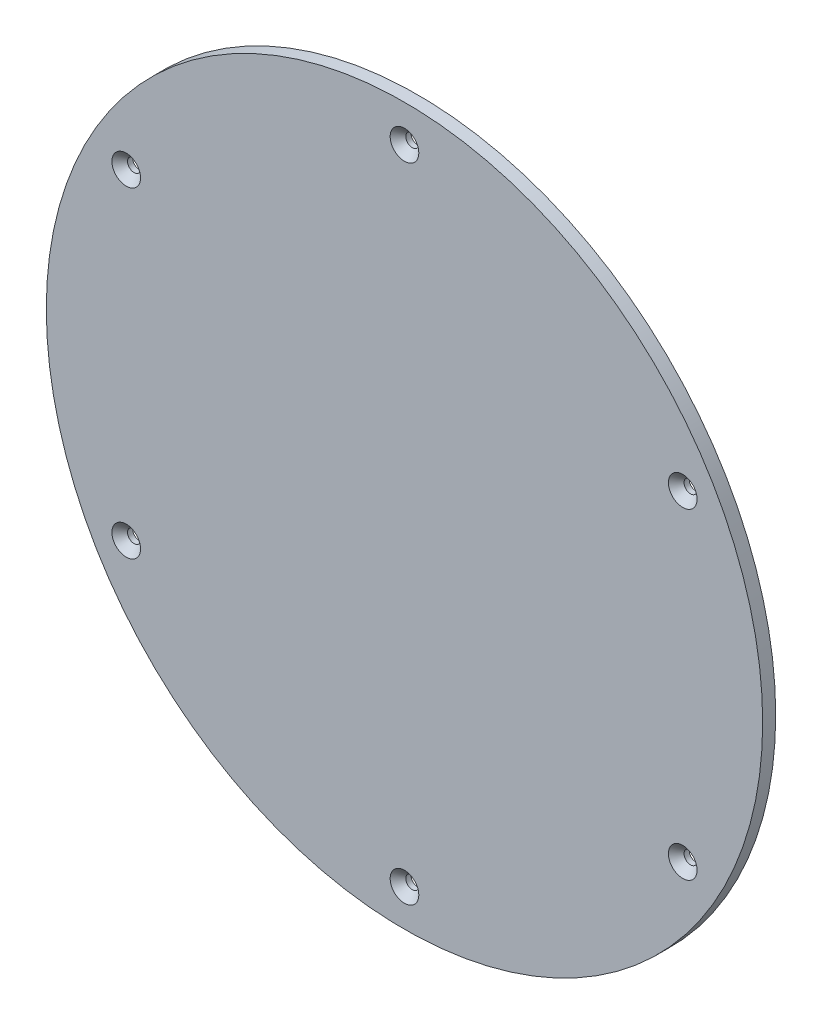
from build123d import *

# Parameters (mm, degrees)
SKETCH1_R           = 82.5
SKETCH1_R_2         = 1.5
BOSS_EXTRUDE1_DEPTH = 3
CHAMFER1_SIZE       = 1.8


with BuildPart() as part:
    # Sketch1 → Boss-Extrude1 (new body)
    with BuildSketch(Plane.XY):
        Circle(SKETCH1_R)
        with Locations((0, 74)):
            Circle(SKETCH1_R_2, mode=Mode.SUBTRACT)
        with Locations((0, -74)):
            Circle(SKETCH1_R_2, mode=Mode.SUBTRACT)
        with Locations((64.08587988, 37)):
            Circle(SKETCH1_R_2, mode=Mode.SUBTRACT)
        with Locations((64.08587988, -37)):
            Circle(SKETCH1_R_2, mode=Mode.SUBTRACT)
        with Locations((-64.08587988, -37)):
            Circle(SKETCH1_R_2, mode=Mode.SUBTRACT)
        with Locations((-64.08587988, 37)):
            Circle(SKETCH1_R_2, mode=Mode.SUBTRACT)
    extrude(amount=BOSS_EXTRUDE1_DEPTH)

    # Chamfer1
    chamfer1_edges = [part.edges().sort_by_distance(p)[0] for p in [
        (62.58587988, 37, 3),
        (62.58587988, -37, 3),
        (-65.58587988, -37, 3),
        (-65.58587988, 37, 3),
        (-1.5, 74, 3),
        (-1.5, -74, 3),
    ]]
    chamfer(chamfer1_edges, length=CHAMFER1_SIZE)


solid = part.part
